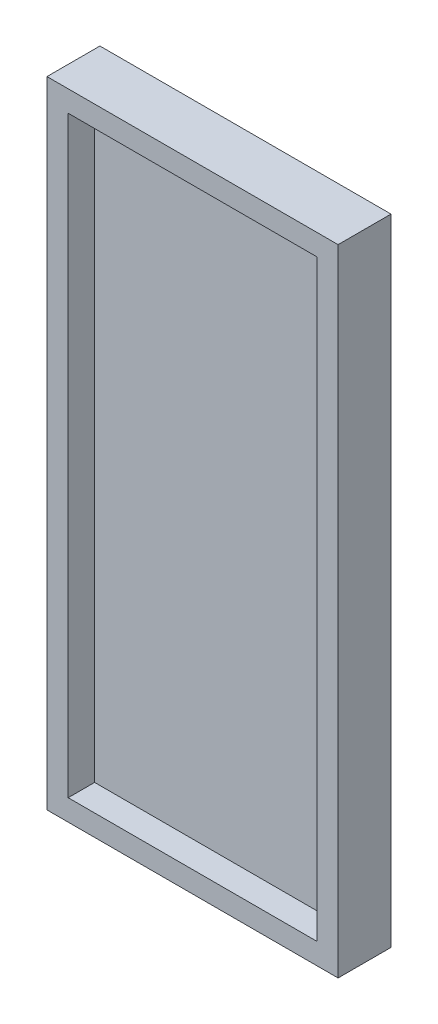
from build123d import *

# Parameters (mm, degrees)
SKETCH1_W           = 120
SKETCH1_H           = 55
BOSS_EXTRUDE1_DEPTH = 10
SKETCH2_W           = 47
SKETCH2_H           = 112
CUT_EXTRUDE1_DEPTH  = 5


with BuildPart() as part:
    # Sketch1 → Boss-Extrude1 (new body)
    with BuildSketch(Plane(origin=(0, 0, 0), x_dir=(0, 1, 0), z_dir=(0, 0, 1))):
        with Locations((60, 27.5)):
            Rectangle(SKETCH1_W, SKETCH1_H)
    extrude(amount=BOSS_EXTRUDE1_DEPTH)

    # Sketch2 → Cut-Extrude1 (cut)
    with BuildSketch(Plane.XY.offset(10)):
        with Locations((-27.5, 60)):
            Rectangle(SKETCH2_W, SKETCH2_H)
    extrude(amount=-CUT_EXTRUDE1_DEPTH, mode=Mode.SUBTRACT)


solid = part.part
